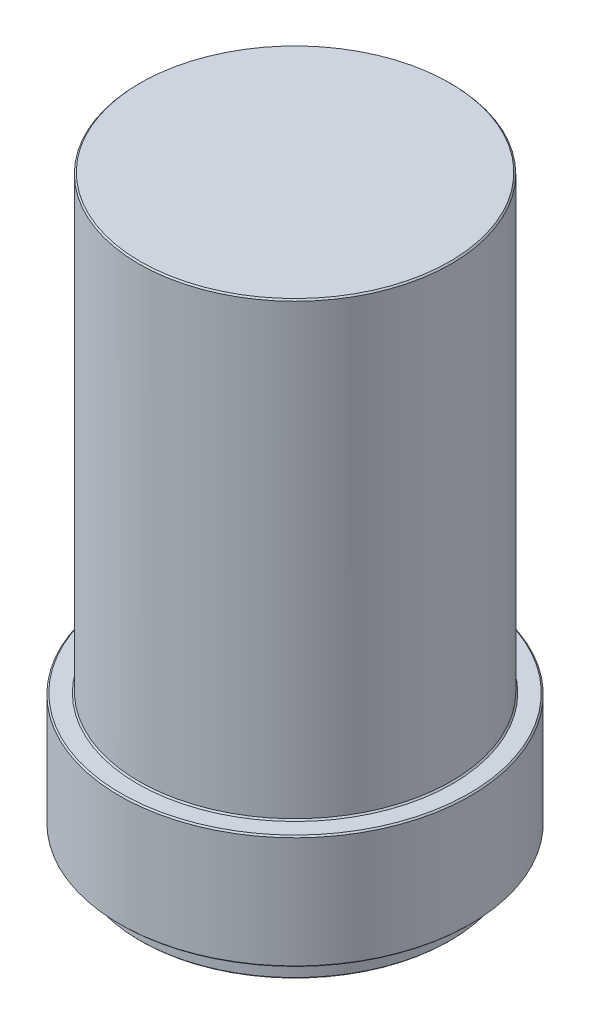
from build123d import *

# Parameters (mm, degrees)
SKETCH1_R           = 22.5
BOSS_EXTRUDE1_DEPTH = 65
SKETCH2_R           = 25.3
BOSS_EXTRUDE2_DEPTH = 16.4
SKETCH3_R           = 22.4
BOSS_EXTRUDE3_DEPTH = 3.5
CHAMFER1_SIZE       = 0.2


with BuildPart() as part:
    # Sketch1 → Boss-Extrude1 (new body)
    with BuildSketch(Plane(origin=(0, 0, 0), x_dir=(1, 0, 0), z_dir=(0, 1, 0))):
        with Locations(Location((0, 0, 0), (0, 0, 270))):
            Circle(SKETCH1_R)
    extrude(amount=BOSS_EXTRUDE1_DEPTH)

    # Sketch2 → Boss-Extrude2 (add)
    with BuildSketch(Plane.XZ):
        with Locations(Location((0, 0, 0), (0, 0, 270))):
            Circle(SKETCH2_R)
    extrude(amount=BOSS_EXTRUDE2_DEPTH)

    # Sketch3 → Boss-Extrude3 (add)
    with BuildSketch(Plane.XZ.offset(16.4)):
        with Locations(Location((0, 0, 0), (0, 0, 270))):
            Circle(SKETCH3_R)
    extrude(amount=BOSS_EXTRUDE3_DEPTH)

    # Chamfer1
    chamfer1_edges = [part.edges().sort_by_distance(p)[0] for p in [
        (0, -19.9, 22.4),
        (0, 65, -22.5),
        (0, 0, -22.5),
        (0, 0, 25.3),
        (0, -16.4, 25.3),
        (0, -16.4, 22.4),
    ]]
    chamfer(chamfer1_edges, length=CHAMFER1_SIZE)


solid = part.part
